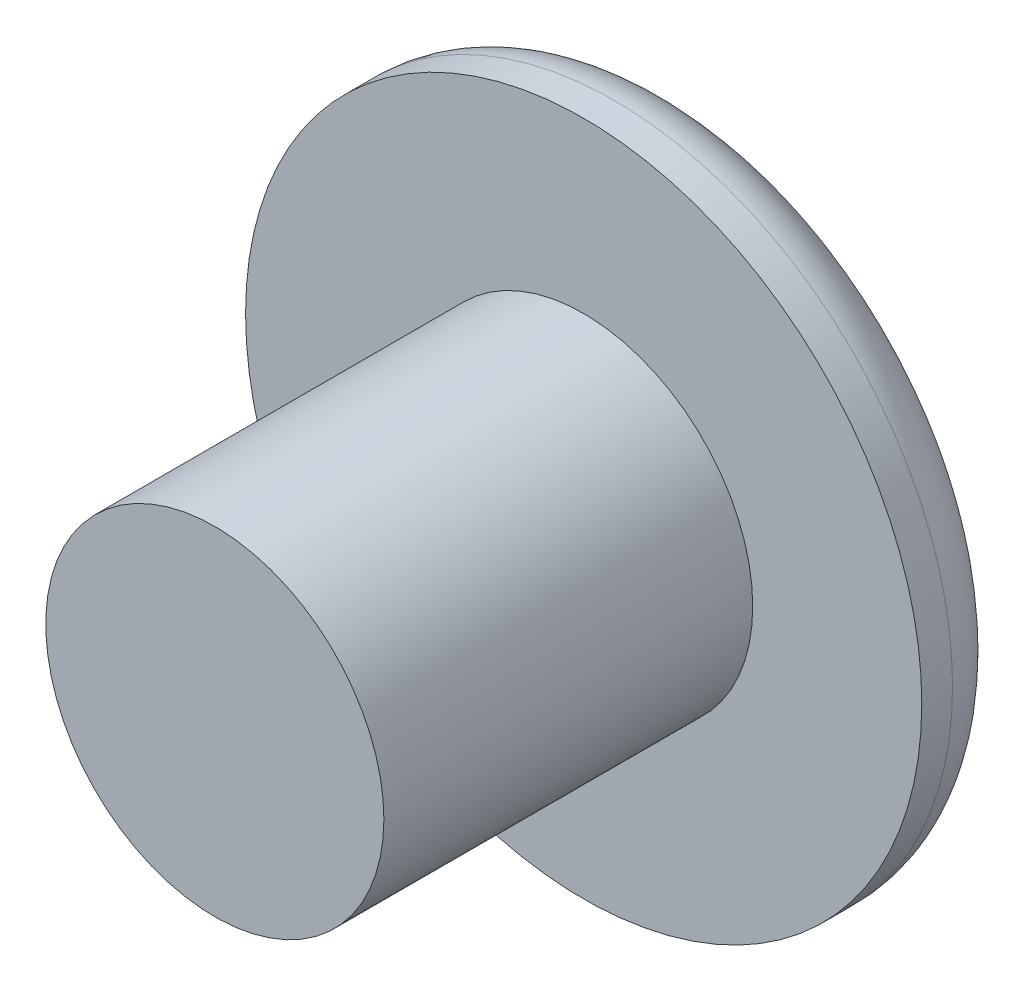
from build123d import *

# Parameters (mm, degrees)
SKETCH1_R           = 5.5
BOSS_EXTRUDE1_DEPTH = 12
SKETCH1_4_R         = 11
SKETCH1_4_R_2       = 5.5
BOSS_EXTRUDE2_DEPTH = 3
BOSS_EXTRUDE3_START = -3
SKETCH1_5_R         = 5.5
BOSS_EXTRUDE3_DEPTH = 3
FILLET1_R           = 2


with BuildPart() as part:
    # Sketch1 → Boss-Extrude1 (new body)
    with BuildSketch(Plane.XY):
        Circle(SKETCH1_R)
    extrude(amount=BOSS_EXTRUDE1_DEPTH)



with BuildPart() as body_2:
    # Sketch1<4> → Boss-Extrude2 (new body)
    with BuildSketch(Plane.XY):
        Circle(SKETCH1_4_R)
        Circle(SKETCH1_4_R_2, mode=Mode.SUBTRACT)
    extrude(amount=-BOSS_EXTRUDE2_DEPTH)


with BuildPart() as part_1:
    add(part.part)

    add(body_2.part)  # Boss-Extrude3 merges body 2
    # Sketch1<5> → Boss-Extrude3 (add)
    with BuildSketch(Plane.XY.offset(BOSS_EXTRUDE3_START)):
        Circle(SKETCH1_5_R)
    extrude(amount=BOSS_EXTRUDE3_DEPTH)

    # Fillet1
    fillet1_edges = [part_1.edges().sort_by_distance(p)[0] for p in [
        (-11, 0, -3),
    ]]
    fillet(fillet1_edges, radius=FILLET1_R)


solid = part_1.part
